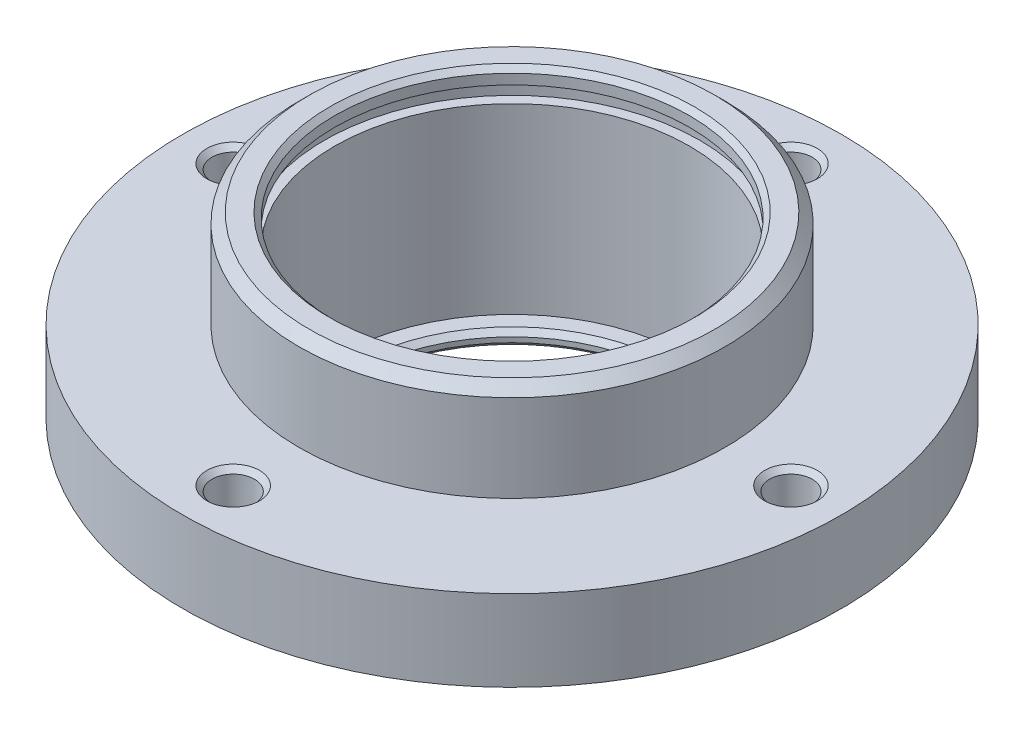
from build123d import *

# Parameters (mm, degrees)
SKETCH_2_R          = 2.1
CUT_EXTRUDE_1_DEPTH = 50.216460661
CHAMFER_1_SIZE      = 0.5
CHAMFER_2_SIZE      = 0.5


with BuildPart() as part:
    # Эскиз1 → Повернуть1 (revolve)
    with BuildSketch(Plane.XY, mode=Mode.PRIVATE) as revolve_1_sk:
        Polygon((-22.5, 5), (-22.5, 2), (-20.5, 0), (-15.5, 0), (-15.5, 1.5), (-17.5, 1.5), (-17.5, 19.5), (-18.5, 19.5), (-18.5, 21.1), (-17.5, 21.1), (-17.5, 22.6), (-20, 22.6), (-21, 21.6), (-21, 13), (-32.5, 13), (-32.5, 5), align=None)
    revolve(revolve_1_sk.sketch.rotate(Axis((0, 0, 0), (0, 1, 0)), 270), axis=Axis((0, 0, 0), (0, 1, 0)))

    # Эскиз2 → Вырез-Вытянуть1 (cut, through all)
    with BuildSketch(Plane.XZ.offset(-5)):
        with Locations((0, 27.5)):
            Circle(SKETCH_2_R)
        with Locations((27.5, 0)):
            Circle(SKETCH_2_R)
        with Locations((0, -27.5)):
            Circle(SKETCH_2_R)
        with Locations((-27.5, 0)):
            Circle(SKETCH_2_R)
    extrude(amount=-CUT_EXTRUDE_1_DEPTH, mode=Mode.SUBTRACT)

    # Фаска1
    chamfer_1_edges = [part.edges().sort_by_distance(p)[0] for p in [
        (0, 0, 15.5),
        (0, 1.5, 15.5),
        (0, 22.6, 17.5),
    ]]
    chamfer(chamfer_1_edges, length=CHAMFER_1_SIZE)

    # Фаска2
    chamfer_2_edges = [part.edges().sort_by_distance(p)[0] for p in [
        (-2.1, 13, 27.5),
        (-2.1, 5, 27.5),
        (25.4, 13, 0),
        (25.4, 5, 0),
        (-2.1, 13, -27.5),
        (-2.1, 5, -27.5),
        (-29.6, 13, 0),
        (-29.6, 5, 0),
    ]]
    chamfer(chamfer_2_edges, length=CHAMFER_2_SIZE)


solid = part.part
